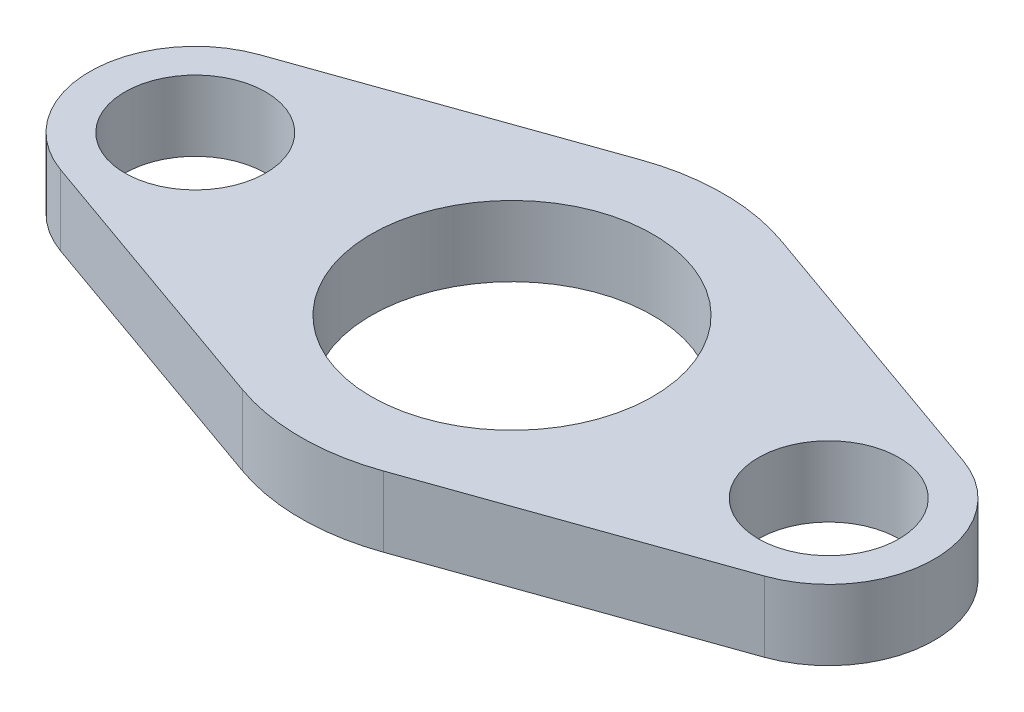
from build123d import *

# Parameters (mm, degrees)
SKETCH1_R           = 20
SKETCH1_R_2         = 10
BOSS_EXTRUDE1_DEPTH = 10


with BuildPart() as part:
    # Sketch1 → Boss-Extrude1 (new body)
    with BuildSketch(Plane(origin=(0, 0, 0), x_dir=(1, 0, 0), z_dir=(0, 1, 0))):
        with BuildLine():
            Line((10, 28.284271247), (50, 14.142135624))
            ThreePointArc((50, 14.142135624), (60, 0), (50, -14.142135624))
            Line((50, -14.142135624), (10, -28.284271247))
            ThreePointArc((10, -28.284271247), (0, -30), (-10, -28.284271247))
            Line((-10, -28.284271247), (-50, -14.142135624))
            ThreePointArc((-50, -14.142135624), (-60, 0), (-50, 14.142135624))
            Line((-50, 14.142135624), (-10, 28.284271247))
            ThreePointArc((-10, 28.284271247), (0, 30), (10, 28.284271247))
        make_face()
        with Locations(Location((0, 0, 0), (0, 0, 270))):
            Circle(SKETCH1_R, mode=Mode.SUBTRACT)
        with Locations(Location((45, 0, 0), (0, 0, 270))):
            Circle(SKETCH1_R_2, mode=Mode.SUBTRACT)
        with Locations(Location((-45, 0, 0), (0, 0, 90))):
            Circle(SKETCH1_R_2, mode=Mode.SUBTRACT)
    extrude(amount=BOSS_EXTRUDE1_DEPTH)


solid = part.part
